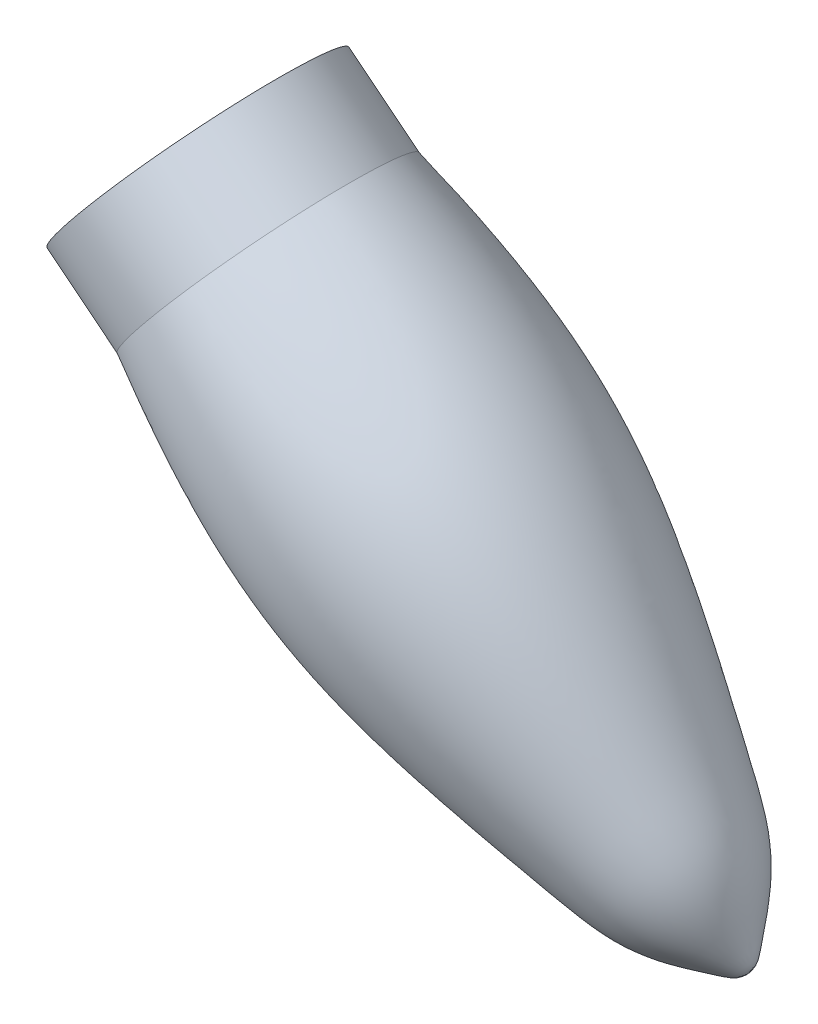
from build123d import *

# Parameters (mm, degrees)
SKETCH_2_R      = 7.119683788
EXTRUDE_1_DEPTH = 5


with BuildPart() as part:
    # 草圖1 → 旋轉1 (revolve)
    with BuildSketch(Plane.XY, mode=Mode.PRIVATE) as revolve_1_sk:
        with BuildLine():
            Line((24.058620343, 13.313293685), (25.42225483, 3.095718132))
            Line((25.42225483, 3.095718132), (46.247768241, -13.597016778))
            add(Edge.make_bspline(
                [(24.058620343, 13.313293685), (34.270288672, 7.693418998), (37.419066258, 3.684577688), (46.067797954, -8.905461472), (46.230805744, -11.086119793), (46.512998534, -13.086449472), (46.369209597, -13.445509036), (46.247768241, -13.597016778)],
                knots=[0, 0, 0, 0, 0.462353853, 0.501037272, 0.589056518, 0.601321919, 0.612688877, 0.612688877, 0.612688877, 0.612688877], degree=3))
        make_face()
    revolve(revolve_1_sk.sketch.rotate(Axis((25.42225483, 3.095718132, 0), (0.7802776783951731, -0.6254332455172484, 0)), 180), axis=Axis((25.42225483, 3.095718132, 0), (0.7802776783951731, -0.6254332455172484, 0)))


with BuildPart() as body_2:
    # 草圖2 → 填料-伸長1 (new body)
    with BuildSketch(Plane(origin=(8.150646381, -6.533168076, 0), x_dir=(0, 0, 1), z_dir=(-0.7802776783951733, 0.6254332455172484, 0))):
        with Locations(Location((0, 18.315443104, 0), (0, 0, 270))):
            Circle(SKETCH_2_R)
    extrude(amount=EXTRUDE_1_DEPTH)


solid = Compound([part.part, body_2.part])
